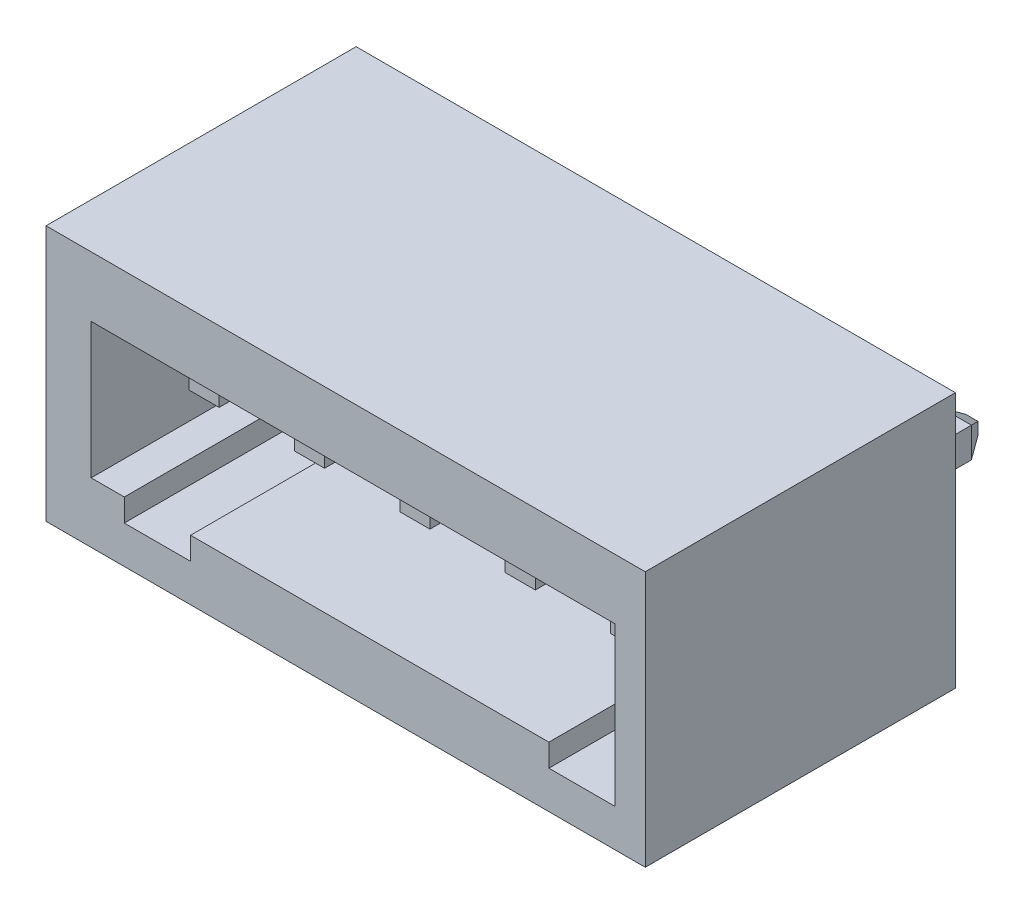
from build123d import *

# Parameters (mm, degrees)
EXTRUDE_1_DEPTH            = 8
EXTRUDE_1_DEPTH_BACK       = 3.5
SKETCH_1_W                 = 1
SKETCH_1_H                 = 1
CHAMFER_1_SIZE             = 0.3
CHAMFER_1_SIZE2            = 0.519615242
PATTERN_LINEAR_1_COUNT     = 5
PATTERN_LINEAR_1_PITCH     = 3.5
SKETCH_3_W                 = 19.9
SKETCH_3_H                 = 8.5
EXTRUDE_2_DEPTH            = 10.3
SHELL_1_T                  = -2
SHELL_1_THICKNESS_2_FACE_W = 4.5
SHELL_1_THICKNESS_2_FACE_H = 8.3
SHELL_1_THICKNESS_2_DEPTH  = 0.5
SHELL_1_THICKNESS_3_FACE_W = 4.5
SHELL_1_THICKNESS_3_FACE_H = 8.3
SHELL_1_THICKNESS_3_DEPTH  = 1
SHELL_1_THICKNESS_4_FACE_W = 17.4
SHELL_1_THICKNESS_4_FACE_H = 4.5
SHELL_1_THICKNESS_4_DEPTH  = 0.5
SKETCH_4_W                 = 2.2
SKETCH_4_H                 = 0.75
CUT_EXTRUDE_1_DEPTH        = 8.8


with BuildPart() as part:
    # Эскиз1 → Бобышка-Вытянуть1 (new, two sides: drawn at the far end of the back side and taken through both)
    with BuildSketch(Plane.XY.offset(-EXTRUDE_1_DEPTH_BACK)):
        with Locations((-7, 0)):
            Rectangle(SKETCH_1_W, SKETCH_1_H)
    extrude(amount=EXTRUDE_1_DEPTH + EXTRUDE_1_DEPTH_BACK)

    # Фаска1
    chamfer_1_edges = [part.edges().sort_by_distance(p)[0] for p in [
        (-7.5, 0, -3.5),
        (-7, -0.5, -3.5),
        (-6.5, 0, -3.5),
        (-7, 0.5, -3.5),
    ]]
    chamfer_1_side = [part.faces().sort_by_distance(p)[0] for p in [
        (-7, 0, -3.5),
    ]]
    chamfer(chamfer_1_edges, length=CHAMFER_1_SIZE, length2=CHAMFER_1_SIZE2, reference=chamfer_1_side[0])


with BuildPart() as pattern_linear_1_1:
    # Линейный массив1: pattern copy
    add(part.part.moved(Location(Vector(1, 0, 0) * (1 * PATTERN_LINEAR_1_PITCH))))


with BuildPart() as pattern_linear_1_2:
    # Линейный массив1: pattern copy
    add(part.part.moved(Location(Vector(1, 0, 0) * (2 * PATTERN_LINEAR_1_PITCH))))


with BuildPart() as pattern_linear_1_3:
    # Линейный массив1: pattern copy
    add(part.part.moved(Location(Vector(1, 0, 0) * (3 * PATTERN_LINEAR_1_PITCH))))


with BuildPart() as pattern_linear_1_4:
    # Линейный массив1: pattern copy
    add(part.part.moved(Location(Vector(1, 0, 0) * (4 * PATTERN_LINEAR_1_PITCH))))


with BuildPart() as body_6:
    # Эскиз3 → Бобышка-Вытянуть2 (new body)
    with BuildSketch(Plane.XY):
        with Locations((0, -0.1)):
            Rectangle(SKETCH_3_W, SKETCH_3_H)
    extrude(amount=EXTRUDE_2_DEPTH)

    # Оболочка1
    shell_1_openings = [body_6.faces().sort_by_distance(p)[0] for p in [
        (0, -0.1, 10.3),
    ]]
    offset(amount=SHELL_1_T, openings=shell_1_openings, kind=Kind.INTERSECTION)

    # Оболочка1 thickness 2 face (on inner face of the shell) → Оболочка1 thickness 2 (cut)
    with BuildSketch(Plane(origin=(-7.95, -0.1, 6.15), x_dir=(0, -1, 0), z_dir=(-1, 0, 0))):
        Rectangle(SHELL_1_THICKNESS_2_FACE_W, SHELL_1_THICKNESS_2_FACE_H)
    extrude(amount=SHELL_1_THICKNESS_2_DEPTH, mode=Mode.SUBTRACT)

    # Оболочка1 thickness 3 face (on inner face of the shell) → Оболочка1 thickness 3 (cut)
    with BuildSketch(Plane(origin=(7.95, -0.1, 6.15), x_dir=(0, 1, 0), z_dir=(1, 0, 0))):
        Rectangle(SHELL_1_THICKNESS_3_FACE_W, SHELL_1_THICKNESS_3_FACE_H)
    extrude(amount=SHELL_1_THICKNESS_3_DEPTH, mode=Mode.SUBTRACT)

    # Оболочка1 thickness 4 face (on inner face of the shell) → Оболочка1 thickness 4 (cut)
    with BuildSketch(Plane(origin=(0.25, -0.1, 2), x_dir=(-1, 0, 0), z_dir=(0, 0, -1))):
        Rectangle(SHELL_1_THICKNESS_4_FACE_W, SHELL_1_THICKNESS_4_FACE_H)
    extrude(amount=SHELL_1_THICKNESS_4_DEPTH, mode=Mode.SUBTRACT)

    # Эскиз4 → Вырез-Вытянуть1 (cut)
    with BuildSketch(Plane.XY.offset(10.3)):
        with Locations((-6.25, -2.725)):
            Rectangle(SKETCH_4_W, SKETCH_4_H)
        with Locations((7.85, -2.725)):
            Rectangle(SKETCH_4_W, SKETCH_4_H)
    extrude(amount=-CUT_EXTRUDE_1_DEPTH, mode=Mode.SUBTRACT)


solid = Compound([part.part, pattern_linear_1_1.part, pattern_linear_1_2.part, pattern_linear_1_3.part, pattern_linear_1_4.part, body_6.part])
